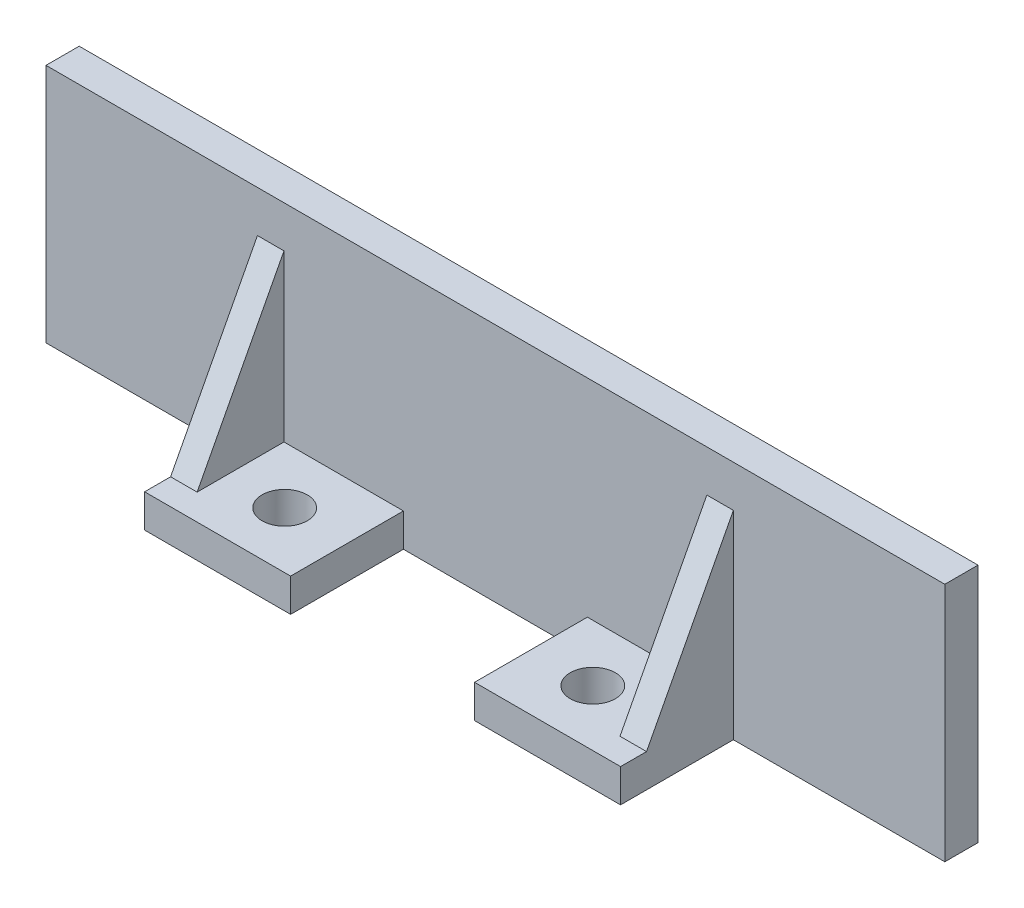
from build123d import *

# Parameters (mm, degrees)
SKETCH1_W           = 86
SKETCH1_H           = 23
BOSS_EXTRUDE1_DEPTH = 3.175
BOSS_EXTRUDE2_DEPTH = 3.175
RIB4_REACH          = 68.401
SKETCH11_WALL_W     = 152.68434621
SKETCH11_WALL_H     = 2.54
SKETCH17_W          = 11.43
SKETCH17_H          = 10.795
CUT_EXTRUDE1_DEPTH  = 127
SKETCH18_R          = 2.159
CUT_EXTRUDE2_DEPTH  = 127


with BuildPart() as part:
    # Sketch1 → Boss-Extrude1 (new body)
    with BuildSketch(Plane.XY):
        Rectangle(SKETCH1_W, SKETCH1_H)
    extrude(amount=-BOSS_EXTRUDE1_DEPTH)

    # Sketch3 → Boss-Extrude2 (add)
    with BuildSketch(Plane(origin=(0, -11.5, 0), x_dir=(-1, 0, 0), z_dir=(0, -1, 0))):
        Polygon((34.200000011, 0), (34.200000011, -10.795), (8.80000001, -10.795), (8.800000011, 0), align=None)
        Polygon((-34.200000011, 0), (-34.200000011, -10.795), (-8.80000001, -10.795), (-8.800000011, 0), align=None)
    extrude(amount=-BOSS_EXTRUDE2_DEPTH)

    # Sketch11 wall → Rib4 (add, up to next)
    with BuildSketch(Plane(origin=(-21.500000011, -0.407189587, 4.154640606), x_dir=(-5.6e-11, -0.885499596527, 0.46464014522), z_dir=(0, 0.46464014522, 0.885499596527)), mode=Mode.PRIVATE) as rib4_sk1:
        Rectangle(SKETCH11_WALL_W, SKETCH11_WALL_H)
    rib4_tool1 = extrude(rib4_sk1.sketch, amount=-RIB4_REACH, mode=Mode.PRIVATE) - part.part
    rib4 = rib4_tool1.solids().sort_by_distance((-21.500000011, -0.407189587, 4.154640606))[0]
    add(rib4)

    # Mirror1: Rib4 across plane
    add(rib4.mirror(Plane(origin=(0, 0, 0), x_dir=(0, 0, 1), z_dir=(1, 0, 0))))

    # Sketch17 → Cut-Extrude1 (cut)
    with BuildSketch(Plane(origin=(0, 11.5, 0), x_dir=(1, 0, 0), z_dir=(0, 1, 0))):
        with Locations((-28.485000011, -5.3975)):
            Rectangle(SKETCH17_W, SKETCH17_H)
    cut_extrude1 = extrude(amount=-CUT_EXTRUDE1_DEPTH, mode=Mode.SUBTRACT)

    # Mirror2: Cut-Extrude1 across plane
    add(cut_extrude1.mirror(Plane(origin=(0, 0, 0), x_dir=(0, 0, 1), z_dir=(1, 0, 0))), mode=Mode.SUBTRACT)

    # Sketch18 → Cut-Extrude2 (cut)
    with BuildSketch(Plane(origin=(0, 11.5, 0), x_dir=(1, 0, 0), z_dir=(0, 1, 0))):
        with Locations(Location((-14.74281704, -5.421760778, 0), (0, 0, 270))):
            Circle(SKETCH18_R)
    cut_extrude2 = extrude(amount=-CUT_EXTRUDE2_DEPTH, mode=Mode.SUBTRACT)

    # Mirror3: Cut-Extrude2 across plane
    add(cut_extrude2.mirror(Plane(origin=(0, 0, 0), x_dir=(0, 0, 1), z_dir=(1, 0, 0))), mode=Mode.SUBTRACT)


solid = part.part
